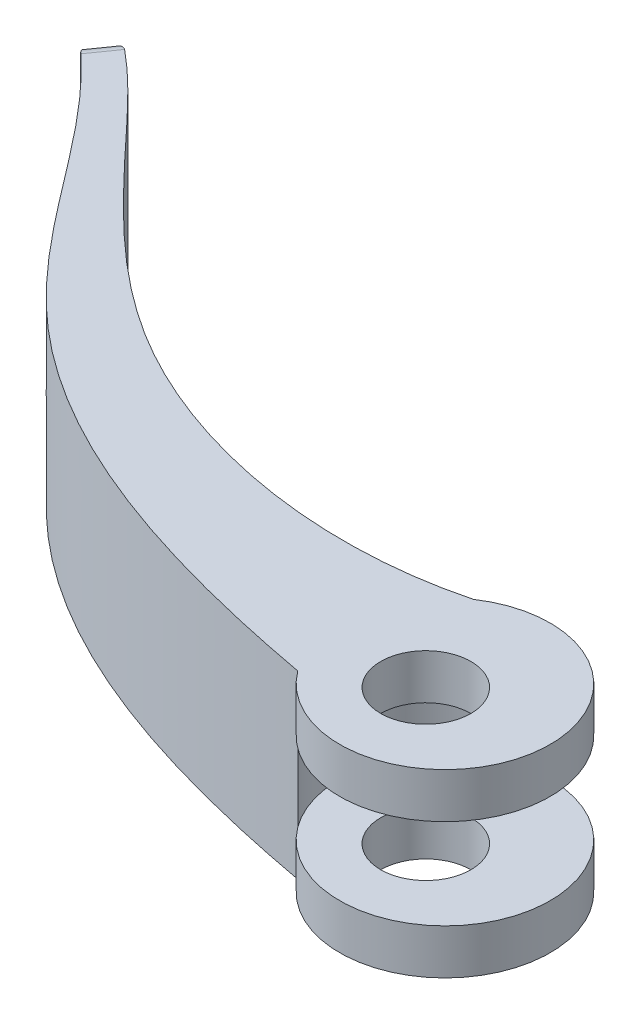
from build123d import *

# Parameters (mm, degrees)
EXTRUDE_1_DEPTH = 12
SKETCH_1_3_R    = 7
SKETCH_1_3_R_2  = 3
EXTRUDE_2_DEPTH = 3
EXTRUDE_START   = 9
SKETCH_1_4_R    = 7
SKETCH_1_4_R_2  = 3
EXTRUDE_3_DEPTH = 3
FILLET_1_R      = 1


with BuildPart() as part:
    # 草图1 → 凸台-拉伸1 (new body)
    with BuildSketch(Plane(origin=(0, 0, 0), x_dir=(1, 0, 0), z_dir=(0, 1, 0))):
        with BuildLine():
            add(Edge.make_bspline(
                [(-3.908610404, 5.807130506), (-12.380011049, 3.605621884), (-27.376579438, 6.317559199), (-39.425413051, 17.773045339), (-45.658717555, 24.846396214), (-47.987295244, 26.48198888)],
                knots=[0, 0, 0, 0, 0.514096191, 0.795654463, 1, 1, 1, 1], degree=3))
            Line((-47.987295244, 26.48198888), (-49.136854466, 24.845372371))
            add(Edge.make_bspline(
                [(-49.136854466, 24.845372371), (-44.808882779, 21.086502798), (-40.758819083, 14.514483032), (-28.442702771, 1.362936195), (-15.62875807, -2.307960271), (-5.630384559, -4.159178971)],
                knots=[0, 0, 0, 0, 0.315330411, 0.428800605, 1, 1, 1, 1], degree=3))
            ThreePointArc((-5.630384559, -4.159178971), (-6.897821205, 1.191663806), (-3.908610404, 5.807130506))
        make_face()
    extrude(amount=EXTRUDE_1_DEPTH)

    # 草图1<3> → 凸台-拉伸2 (add)
    with BuildSketch(Plane(origin=(0, 0, 0), x_dir=(1, 0, 0), z_dir=(0, 1, 0))):
        Circle(SKETCH_1_3_R)
        with Locations(Location((-0.421324482, -0.852481629, 0), (0, 0, 270))):
            Circle(SKETCH_1_3_R_2, mode=Mode.SUBTRACT)
    extrude(amount=EXTRUDE_2_DEPTH)

    # 草图1<4> → 凸台-拉伸3 (add)
    with BuildSketch(Plane(origin=(0, 0, 0), x_dir=(1, 0, 0), z_dir=(0, 1, 0)).offset(EXTRUDE_START)):
        Circle(SKETCH_1_4_R)
        with Locations(Location((-0.421324482, -0.852481629, 0), (0, 0, 270))):
            Circle(SKETCH_1_4_R_2, mode=Mode.SUBTRACT)
    extrude(amount=EXTRUDE_3_DEPTH)

    # 圆角1
    fillet_1_edges = [part.edges().sort_by_distance(p)[0] for p in [
        (-47.987295244, 6, -26.48198888),
        (-48.562074855, 0, -25.663680626),
        (-48.562074855, 12, -25.663680626),
        (-49.136854466, 6, -24.845372371),
    ]]
    fillet(fillet_1_edges, radius=FILLET_1_R)


solid = part.part
